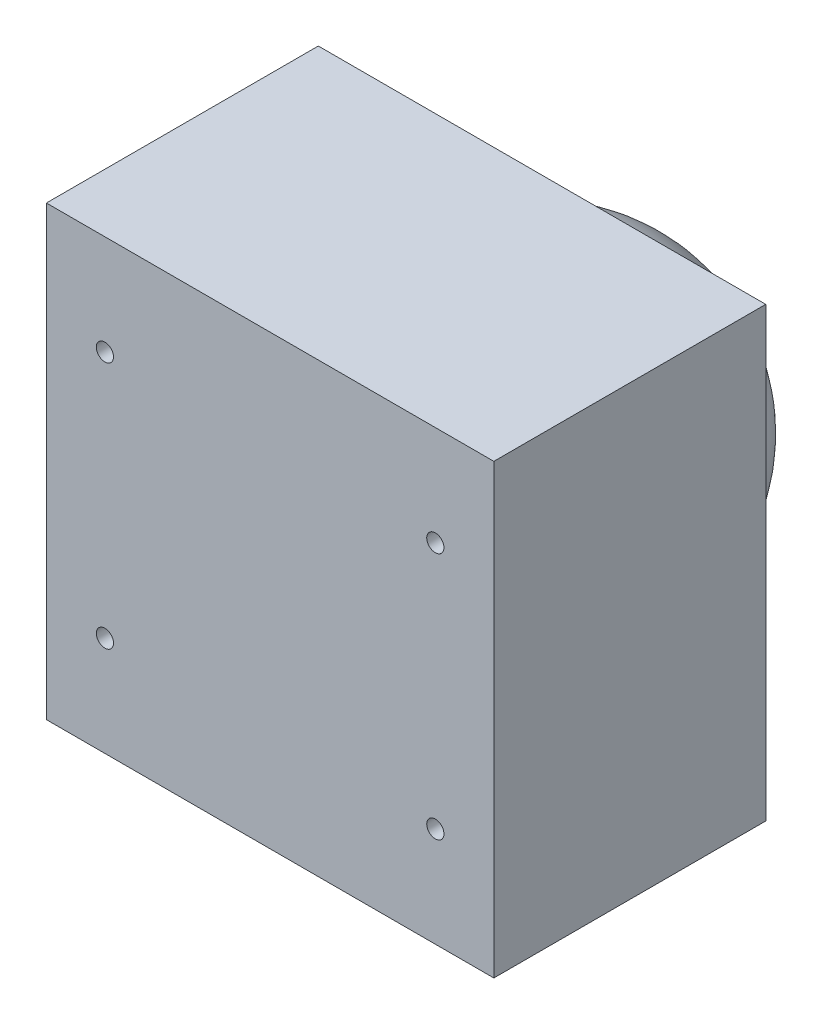
from build123d import *

# Parameters (mm, degrees)
SCHIZZO1_W                   = 65
SCHIZZO1_H                   = 65
ESTRUSIONE_ESTRUSIONE1_DEPTH = 39.5
SCHIZZO14_R                  = 6
ESTRUSIONE_ESTRUSIONE2_DEPTH = 7
FORO_FILETTATO_M3_1_D        = 2.5
FORO_FILETTATO_M3_1_DEPTH    = 4.248924226
FORO_FILETTATO_M3_1_TIP      = 0.751075774


with BuildPart() as part:
    # Schizzo1 → Estrusione-Estrusione1 (new body)
    with BuildSketch(Plane.XY):
        Rectangle(SCHIZZO1_W, SCHIZZO1_H)
    extrude(amount=ESTRUSIONE_ESTRUSIONE1_DEPTH)

    # Schizzo2 → Rivoluzione1 (revolve)
    with BuildSketch(Plane(origin=(0, 0, 0), x_dir=(1, 0, 0), z_dir=(0, 1, 0))):
        with BuildLine():
            Line((0, 0), (0, 20.5))
            Line((0, 20.5), (12.479983974, 20.5))
            ThreePointArc((12.479983974, 20.5), (20.922710333, 11.757558943), (24, 0))
            Line((24, 0), (0, 0))
        make_face()
    revolve(axis=Axis((0, 0, 0), (0, 0, -1)))

    # Schizzo14 → Estrusione-Estrusione2 (add)
    with BuildSketch(Plane.ZY.offset(32.5)):
        with Locations(Location((25.2, 0, 0), (0, 0, 270))):
            Circle(SCHIZZO14_R)
    extrude(amount=ESTRUSIONE_ESTRUSIONE2_DEPTH)

    # Foro filettato M3-1
    with Locations(Plane(origin=(-24, 18, 39.5), x_dir=(1, 0, 0), z_dir=(0, 0, 1))):
        with Locations((0, 0), (0, -36), (48, 0), (48, -36)):
            Hole(FORO_FILETTATO_M3_1_D / 2, depth=FORO_FILETTATO_M3_1_DEPTH)
            with Locations((0, 0, -(FORO_FILETTATO_M3_1_DEPTH + FORO_FILETTATO_M3_1_TIP / 2))):  # 118° drill point
                Cone(0, FORO_FILETTATO_M3_1_D / 2, FORO_FILETTATO_M3_1_TIP, mode=Mode.SUBTRACT)


solid = part.part
